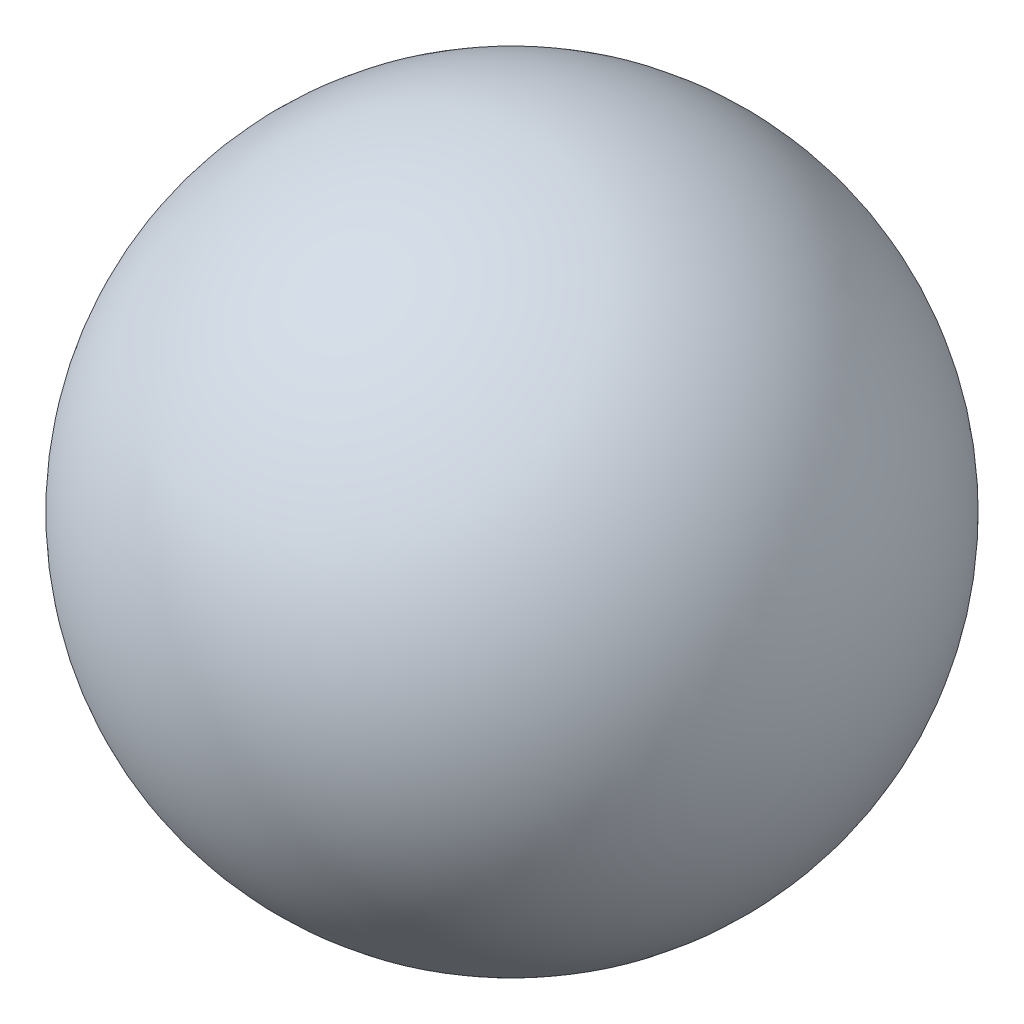
from build123d import *


with BuildPart() as part:
    # Sketch1 → Revolve2 (revolve)
    with BuildSketch(Plane.XY):
        with BuildLine():
            Line((0, 232.833333333), (0, 239.183333333))
            ThreePointArc((0, 239.183333333), (-82.55, 156.633333333), (0, 74.083333333))
            Line((0, 74.083333333), (0, 80.433333333))
            ThreePointArc((0, 80.433333333), (-76.2, 156.633333333), (0, 232.833333333))
        make_face()
    revolve(axis=Axis((0, 232.833333333, 0), (0, 1, 0)))


solid = part.part
